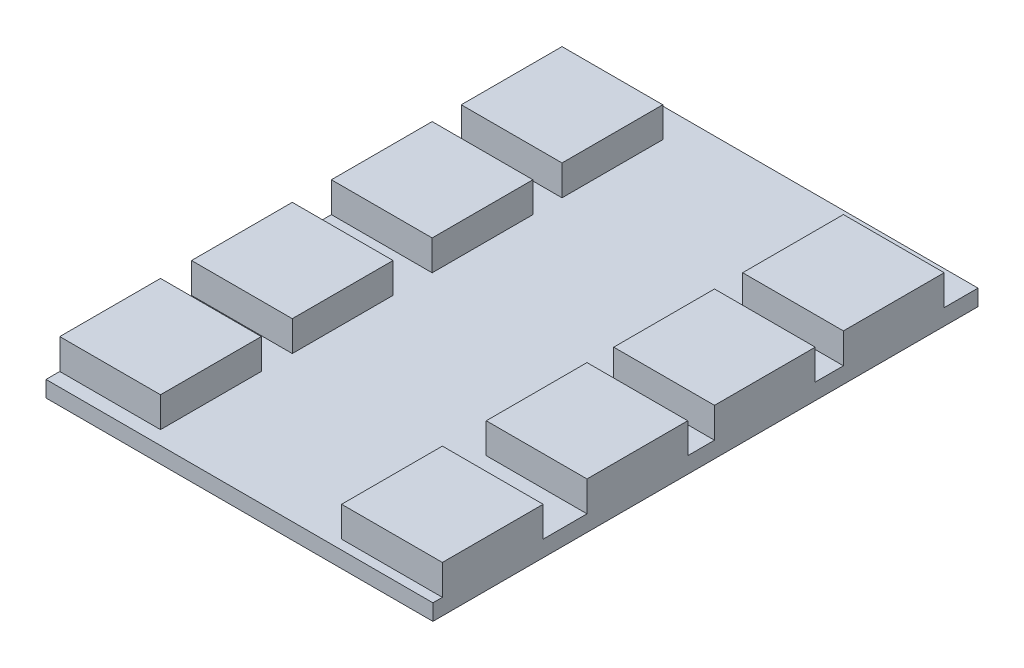
from build123d import *

# Parameters (mm, degrees)
SKETCH_1_W      = 38.4
SKETCH_1_H      = 54.1
EXTRUDE_1_DEPTH = 0.8
SKETCH_2_W      = 10
SKETCH_2_H      = 10
EXTRUDE_2_DEPTH = 3


with BuildPart() as part:
    # Эскиз1 → Бобышка-Вытянуть1 (new, symmetric)
    with BuildSketch(Plane(origin=(0, 0, 0), x_dir=(1, 0, 0), z_dir=(0, 1, 0))):
        Rectangle(SKETCH_1_W, SKETCH_1_H)
    extrude(amount=EXTRUDE_1_DEPTH, both=True)

    # Эскиз2 → Бобышка-Вытянуть2 (add)
    with BuildSketch(Plane(origin=(0, 0.8, 0), x_dir=(1, 0, 0), z_dir=(0, 1, 0))):
        with Locations((-14.2, 19.164621175)):
            Rectangle(SKETCH_2_W, SKETCH_2_H)
        with Locations((-14.2, 6.274815906)):
            Rectangle(SKETCH_2_W, SKETCH_2_H)
        with Locations((-14.2, -7.606512846)):
            Rectangle(SKETCH_2_W, SKETCH_2_H)
        with Locations((-14.2, -20.685179731)):
            Rectangle(SKETCH_2_W, SKETCH_2_H)
        with Locations((14.2, 18.692467136)):
            Rectangle(SKETCH_2_W, SKETCH_2_H)
        with Locations((14.2, 5.897092674)):
            Rectangle(SKETCH_2_W, SKETCH_2_H)
        with Locations((14.2, -6.756635575)):
            Rectangle(SKETCH_2_W, SKETCH_2_H)
        with Locations((14.2, -21.110118366)):
            Rectangle(SKETCH_2_W, SKETCH_2_H)
    extrude(amount=EXTRUDE_2_DEPTH)


solid = part.part
